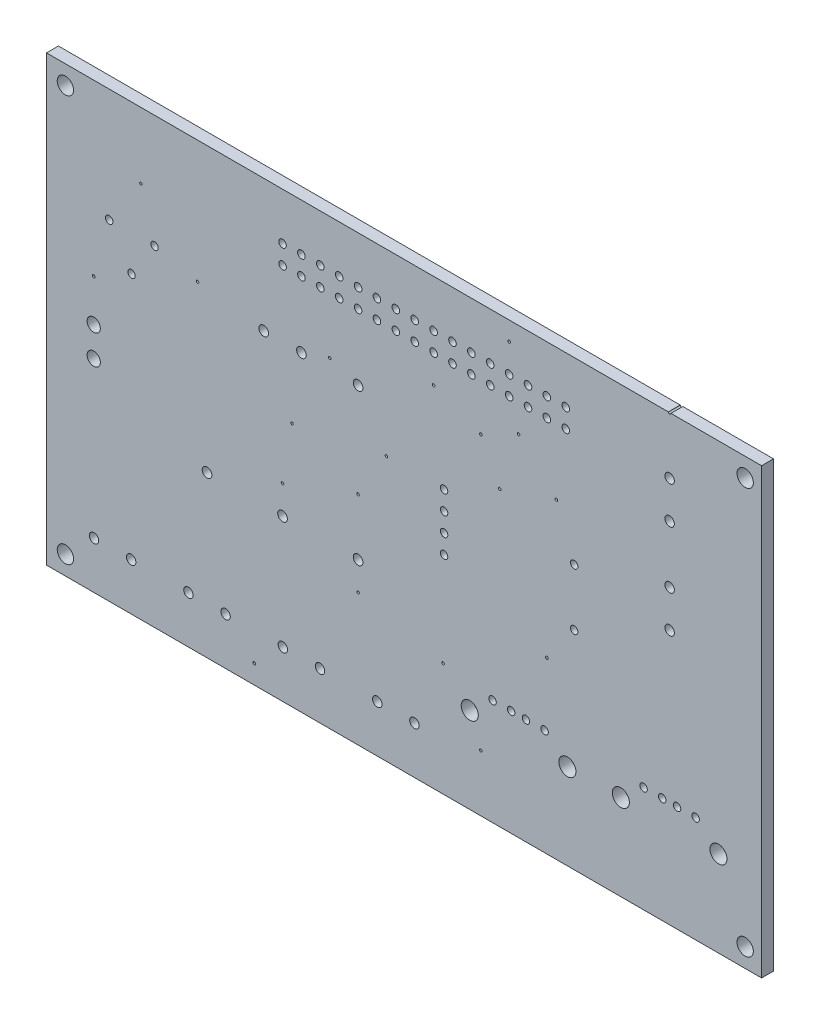
from build123d import *

# Parameters (mm, degrees)
SKETCH1_W           = 96.19
SKETCH1_H           = 59.68
BOARD_OUTLINE_DEPTH = 1.6
SKETCH2_R           = 1.1
SKETCH2_R_2         = 1.15
SKETCH2_R_3         = 0.175
NPTH_DEPTH          = 123.715899948
SKETCH3_R           = 0.5
SKETCH3_R_2         = 0.89
SKETCH3_R_3         = 0.635
SKETCH3_R_4         = 0.51
SKETCH3_R_5         = 0.65
PTH_DEPTH           = 123.715899948


with BuildPart() as part:
    # Sketch1 → Board_Outline (new body)
    with BuildSketch(Plane.XY):
        with Locations((51.905, 41.27)):
            Rectangle(SKETCH1_W, SKETCH1_H)
    extrude(amount=BOARD_OUTLINE_DEPTH)

    # Sketch2 → NPTH (cut, through all)
    with BuildSketch(Plane.XY):
        with Locations((6.35, 13.97)):
            Circle(SKETCH2_R)
        with Locations((6.35, 68.58)):
            Circle(SKETCH2_R)
        with Locations((97.79, 68.58)):
            Circle(SKETCH2_R)
        with Locations((97.79, 13.97)):
            Circle(SKETCH2_R)
        with Locations((81.06, 22.9799)):
            Circle(SKETCH2_R_2)
        with Locations((94.2, 22.9799)):
            Circle(SKETCH2_R_2)
        with Locations((60.74, 22.9799)):
            Circle(SKETCH2_R_2)
        with Locations((73.88, 22.9799)):
            Circle(SKETCH2_R_2)
        with Locations((62.23, 55.88)):
            Circle(SKETCH2_R_3)
        with Locations((71.12, 34.29)):
            Circle(SKETCH2_R_3)
        with Locations((36.83, 44.45)):
            Circle(SKETCH2_R_3)
        with Locations((41.91, 54.61)):
            Circle(SKETCH2_R_3)
        with Locations((45.72, 29.21)):
            Circle(SKETCH2_R_3)
        with Locations((62.23, 19.05)):
            Circle(SKETCH2_R_3)
        with Locations((31.75, 13.97)):
            Circle(SKETCH2_R_3)
        with Locations((55.88, 58.42)):
            Circle(SKETCH2_R_3)
        with Locations((16.51, 62.23)):
            Circle(SKETCH2_R_3)
        with Locations((24.13, 54.61)):
            Circle(SKETCH2_R_3)
        with Locations((45.72, 40.64)):
            Circle(SKETCH2_R_3)
        with Locations((49.53, 46.99)):
            Circle(SKETCH2_R_3)
        with Locations((57.15, 26.67)):
            Circle(SKETCH2_R_3)
        with Locations((10.16, 48.26)):
            Circle(SKETCH2_R_3)
        with Locations((66.04, 68.58)):
            Circle(SKETCH2_R_3)
        with Locations((87.63, 71.12)):
            Circle(SKETCH2_R_3)
        with Locations((72.39, 53.34)):
            Circle(SKETCH2_R_3)
        with Locations((67.31, 58.42)):
            Circle(SKETCH2_R_3)
        with Locations((64.77, 50.8)):
            Circle(SKETCH2_R_3)
        with Locations((35.56, 36.83)):
            Circle(SKETCH2_R_3)
    extrude(amount=NPTH_DEPTH, mode=Mode.SUBTRACT)

    # Sketch3 → PTH (cut, through all)
    with BuildSketch(Plane.XY):
        with Locations((18.34, 55.88)):
            Circle(SKETCH3_R)
        with Locations((15.24, 51.08)):
            Circle(SKETCH3_R)
        with Locations((12.24, 55.88)):
            Circle(SKETCH3_R)
        with Locations((10.16, 38.66)):
            Circle(SKETCH3_R_2)
        with Locations((10.16, 42.62)):
            Circle(SKETCH3_R_2)
        with Locations((87.63, 58.46)):
            Circle(SKETCH3_R_3)
        with Locations((87.63, 63.46)):
            Circle(SKETCH3_R_3)
        with Locations((57.29, 46.99)):
            Circle(SKETCH3_R)
        with Locations((57.29, 44.45)):
            Circle(SKETCH3_R)
        with Locations((57.29, 41.91)):
            Circle(SKETCH3_R)
        with Locations((57.29, 39.37)):
            Circle(SKETCH3_R)
        with Locations((74.79, 39.37)):
            Circle(SKETCH3_R)
        with Locations((74.79, 46.99)):
            Circle(SKETCH3_R)
        with Locations((87.63, 45.76)):
            Circle(SKETCH3_R_3)
        with Locations((87.63, 50.76)):
            Circle(SKETCH3_R_3)
        with Locations((35.56, 64.77)):
            Circle(SKETCH3_R_4)
        with Locations((35.56, 62.23)):
            Circle(SKETCH3_R_4)
        with Locations((38.1, 64.77)):
            Circle(SKETCH3_R_4)
        with Locations((38.1, 62.23)):
            Circle(SKETCH3_R_4)
        with Locations((40.64, 64.77)):
            Circle(SKETCH3_R_4)
        with Locations((40.64, 62.23)):
            Circle(SKETCH3_R_4)
        with Locations((43.18, 64.77)):
            Circle(SKETCH3_R_4)
        with Locations((43.18, 62.23)):
            Circle(SKETCH3_R_4)
        with Locations((45.72, 64.77)):
            Circle(SKETCH3_R_4)
        with Locations((45.72, 62.23)):
            Circle(SKETCH3_R_4)
        with Locations((48.26, 64.77)):
            Circle(SKETCH3_R_4)
        with Locations((48.26, 62.23)):
            Circle(SKETCH3_R_4)
        with Locations((50.8, 64.77)):
            Circle(SKETCH3_R_4)
        with Locations((50.8, 62.23)):
            Circle(SKETCH3_R_4)
        with Locations((53.34, 64.77)):
            Circle(SKETCH3_R_4)
        with Locations((53.34, 62.23)):
            Circle(SKETCH3_R_4)
        with Locations((55.88, 64.77)):
            Circle(SKETCH3_R_4)
        with Locations((55.88, 62.23)):
            Circle(SKETCH3_R_4)
        with Locations((58.42, 64.77)):
            Circle(SKETCH3_R_4)
        with Locations((58.42, 62.23)):
            Circle(SKETCH3_R_4)
        with Locations((60.96, 64.77)):
            Circle(SKETCH3_R_4)
        with Locations((60.96, 62.23)):
            Circle(SKETCH3_R_4)
        with Locations((63.5, 64.77)):
            Circle(SKETCH3_R_4)
        with Locations((63.5, 62.23)):
            Circle(SKETCH3_R_4)
        with Locations((66.04, 64.77)):
            Circle(SKETCH3_R_4)
        with Locations((66.04, 62.23)):
            Circle(SKETCH3_R_4)
        with Locations((68.58, 64.77)):
            Circle(SKETCH3_R_4)
        with Locations((68.58, 62.23)):
            Circle(SKETCH3_R_4)
        with Locations((71.12, 64.77)):
            Circle(SKETCH3_R_4)
        with Locations((71.12, 62.23)):
            Circle(SKETCH3_R_4)
        with Locations((73.66, 64.77)):
            Circle(SKETCH3_R_4)
        with Locations((73.66, 62.23)):
            Circle(SKETCH3_R_4)
        with Locations((40.6, 17.78)):
            Circle(SKETCH3_R_3)
        with Locations((35.6, 17.78)):
            Circle(SKETCH3_R_3)
        with Locations((15.2, 17.78)):
            Circle(SKETCH3_R_3)
        with Locations((10.2, 17.78)):
            Circle(SKETCH3_R_3)
        with Locations((27.9, 17.78)):
            Circle(SKETCH3_R_3)
        with Locations((22.9, 17.78)):
            Circle(SKETCH3_R_3)
        with Locations((53.3, 17.78)):
            Circle(SKETCH3_R_3)
        with Locations((48.3, 17.78)):
            Circle(SKETCH3_R_3)
        with Locations((33.02, 53.34)):
            Circle(SKETCH3_R_5)
        with Locations((25.4, 33.02)):
            Circle(SKETCH3_R_5)
        with Locations((38.1, 53.34)):
            Circle(SKETCH3_R_5)
        with Locations((45.72, 33.02)):
            Circle(SKETCH3_R_5)
        with Locations((45.72, 53.34)):
            Circle(SKETCH3_R_5)
        with Locations((35.56, 33.02)):
            Circle(SKETCH3_R_5)
        with Locations((84.13, 25.69)):
            Circle(SKETCH3_R)
        with Locations((86.63, 25.69)):
            Circle(SKETCH3_R)
        with Locations((88.63, 25.69)):
            Circle(SKETCH3_R)
        with Locations((91.13, 25.69)):
            Circle(SKETCH3_R)
        with Locations((63.81, 25.69)):
            Circle(SKETCH3_R)
        with Locations((66.31, 25.69)):
            Circle(SKETCH3_R)
        with Locations((68.31, 25.69)):
            Circle(SKETCH3_R)
        with Locations((70.81, 25.69)):
            Circle(SKETCH3_R)
    extrude(amount=PTH_DEPTH, mode=Mode.SUBTRACT)


solid = part.part
